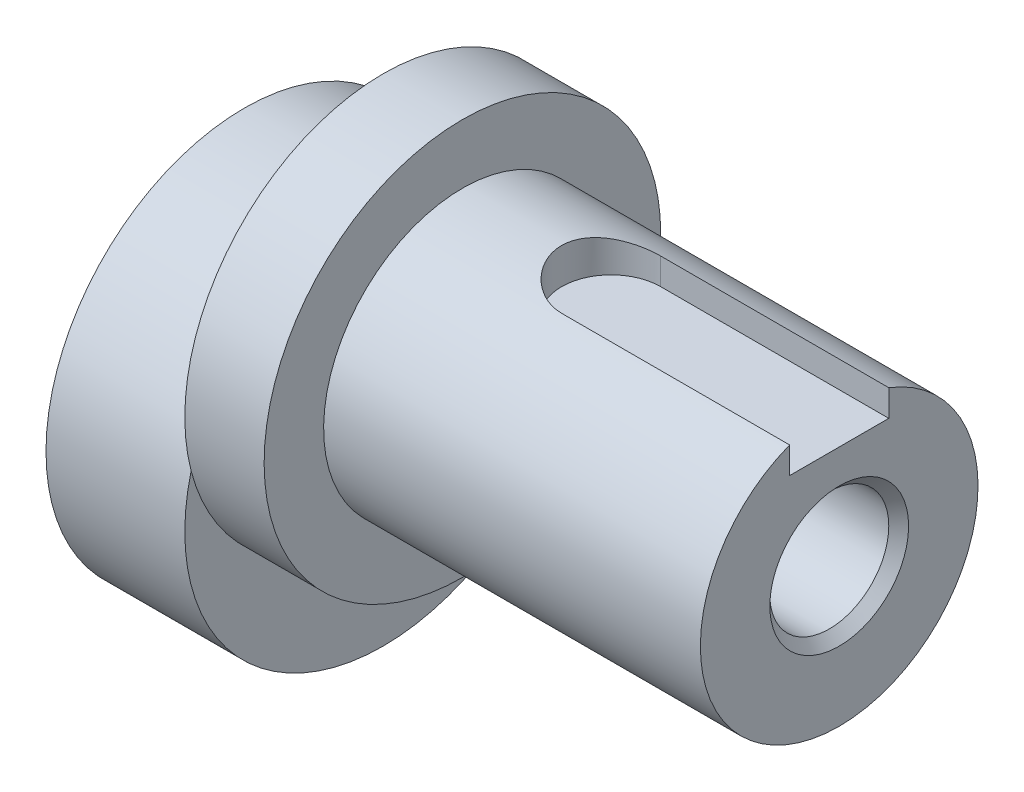
from build123d import *

# Parameters (mm, degrees)
SKETCH1_R               = 10
BOSS_EXTRUDE1_DEPTH     = 7
SKETCH2_R               = 10
BOSS_EXTRUDE2_DEPTH     = 4
SKETCH3_R               = 7
BOSS_EXTRUDE3_DEPTH     = 19
CUT_EXTRUDE1_DEPTH      = 36
CUT_EXTRUDE1_DEPTH_BACK = 36
SKETCH4_R               = 3
CHAMFER1_SIZE           = 0.5
CUT_EXTRUDE2_START      = 10.2
CUT_EXTRUDE2_DEPTH      = 19


with BuildPart() as part:
    # Sketch1 → Boss-Extrude1 (new body)
    with BuildSketch(Plane(origin=(0, 0, 0), x_dir=(0, 0, -1), z_dir=(1, 0, 0))):
        Circle(SKETCH1_R)
    extrude(amount=BOSS_EXTRUDE1_DEPTH)

    # Sketch2 → Boss-Extrude2 (add)
    with BuildSketch(Plane(origin=(7, 0, 0), x_dir=(0, 0, -1), z_dir=(1, 0, 0))):
        with Locations(Location((0, 5, 0), (0, 0, 194.477512186))):
            Circle(SKETCH2_R)
    extrude(amount=BOSS_EXTRUDE2_DEPTH)

    # Sketch3 → Boss-Extrude3 (add)
    with BuildSketch(Plane(origin=(11, 0, 0), x_dir=(0, 0, -1), z_dir=(1, 0, 0))):
        with Locations((0, 5)):
            Circle(SKETCH3_R)
    extrude(amount=BOSS_EXTRUDE3_DEPTH)

    # Sketch4 → Cut-Extrude1 (cut, two sides: drawn at the far end of the back side and taken through both)
    with BuildSketch(Plane(origin=(30, 0, 0), x_dir=(0, 0, -1), z_dir=(1, 0, 0)).offset(-CUT_EXTRUDE1_DEPTH_BACK)):
        with Locations((0, 5)):
            Circle(SKETCH4_R)
    extrude(amount=CUT_EXTRUDE1_DEPTH + CUT_EXTRUDE1_DEPTH_BACK, mode=Mode.SUBTRACT)

    # Chamfer1
    chamfer1_edges = [part.edges().sort_by_distance(p)[0] for p in [
        (30, 5, 3),
        (0, 5, 3),
    ]]
    chamfer(chamfer1_edges, length=CHAMFER1_SIZE)

    # Sketch5 → Cut-Extrude2 (cut)
    with BuildSketch(Plane(origin=(0, 0, 0), x_dir=(1, 0, 0), z_dir=(0, 1, 0)).offset(CUT_EXTRUDE2_START)):
        with BuildLine():
            Line((32.790788437, 2.5), (18.5, 2.5))
            ThreePointArc((18.5, 2.5), (16, 0), (18.5, -2.5))
            Line((18.5, -2.5), (32.790788437, -2.5))
            Line((32.790788437, -2.5), (32.790788437, 2.5))
        make_face()
    extrude(amount=CUT_EXTRUDE2_DEPTH, mode=Mode.SUBTRACT)


solid = part.part
